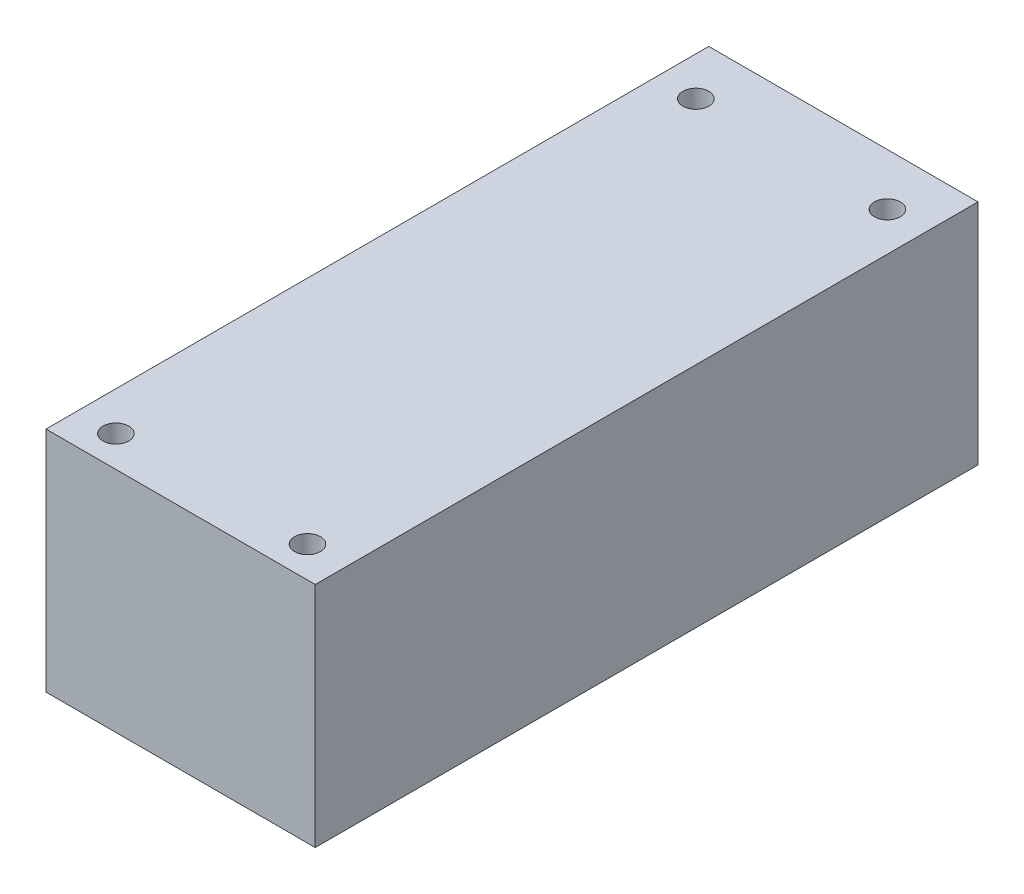
from build123d import *

# Parameters (mm, degrees)
SKETCH_1_W          = 26
SKETCH_1_H          = 22
EXTRUDE_1_DEPTH     = 32
SKETCH_2_R          = 1.25
CUT_EXTRUDE_1_DEPTH = 40


with BuildPart() as part:
    # 草图1 → 凸台-拉伸1 (new, symmetric)
    with BuildSketch(Plane.XY):
        Rectangle(SKETCH_1_W, SKETCH_1_H)
    extrude(amount=EXTRUDE_1_DEPTH, both=True)

    # 草图2 → 切除-拉伸1 (cut)
    with BuildSketch(Plane(origin=(0, 11, 0), x_dir=(1, 0, 0), z_dir=(0, 1, 0))):
        with Locations(Location((9.25, -29, 0), (0, 0, 180))):
            Circle(SKETCH_2_R)
        with Locations(Location((9.25, 27, 0), (0, 0, 180))):
            Circle(SKETCH_2_R)
        with Locations(Location((-9.25, 27, 0), (0, 0, 180))):
            Circle(SKETCH_2_R)
        with Locations(Location((-9.25, -29, 0), (0, 0, 180))):
            Circle(SKETCH_2_R)
    extrude(amount=-CUT_EXTRUDE_1_DEPTH, mode=Mode.SUBTRACT)


solid = part.part
